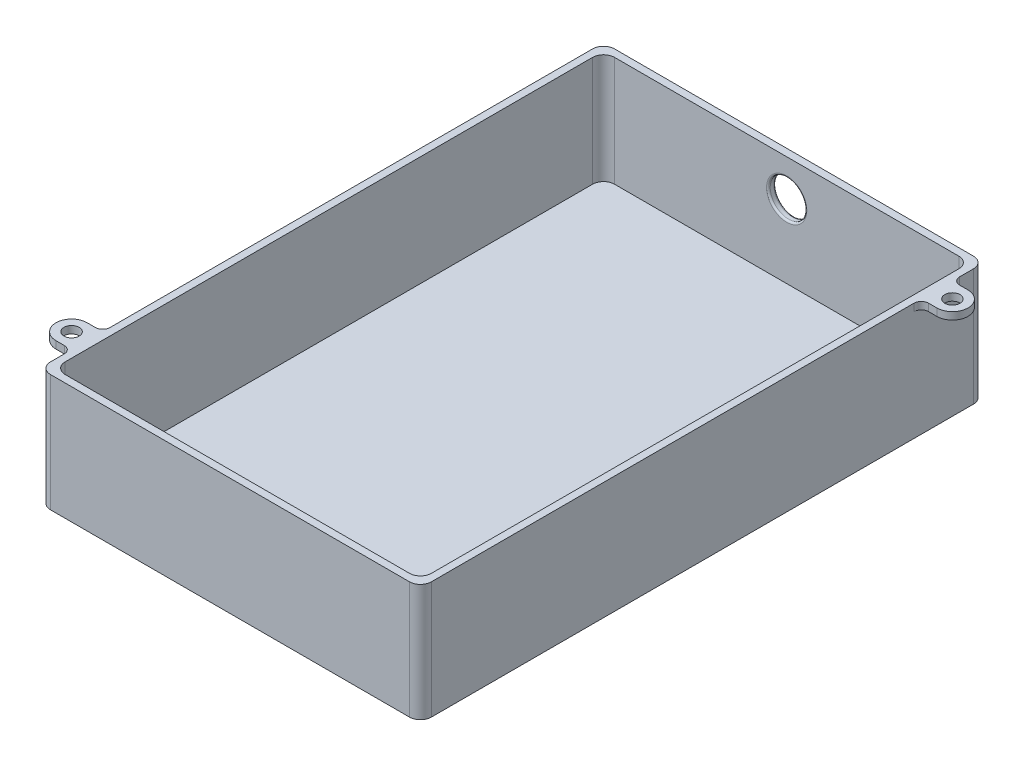
from build123d import *

# Parameters (mm, degrees)
SKETCH1_W           = 104
SKETCH1_H           = 154
SKETCH1_W_2         = 100
SKETCH1_H_2         = 150
BOSS_EXTRUDE1_DEPTH = 30
SKETCH1_2_W         = 104
SKETCH1_2_H         = 154
BOSS_EXTRUDE2_DEPTH = 2
FILLET1_R           = 3
SKETCH2_R           = 2.075
BOSS_EXTRUDE3_DEPTH = 2
SKETCH3_R           = 2.075
BOSS_EXTRUDE4_DEPTH = 2
SKETCH4_R           = 5
CUT_EXTRUDE1_DEPTH  = 10
FILLET2_R           = 0.5
FILLET3_R           = 2


with BuildPart() as part:
    # Sketch1 → Boss-Extrude1 (new body)
    with BuildSketch(Plane(origin=(0, 0, 0), x_dir=(1, 0, 0), z_dir=(0, 1, 0))):
        Rectangle(SKETCH1_W, SKETCH1_H)
        Rectangle(SKETCH1_W_2, SKETCH1_H_2, mode=Mode.SUBTRACT)
    extrude(amount=BOSS_EXTRUDE1_DEPTH)

    # Sketch1<2> → Boss-Extrude2 (add)
    with BuildSketch(Plane(origin=(0, 0, 0), x_dir=(1, 0, 0), z_dir=(0, 1, 0))):
        Rectangle(SKETCH1_2_W, SKETCH1_2_H)
    extrude(amount=-BOSS_EXTRUDE2_DEPTH)

    # Fillet1
    fillet1_edges = [part.edges().sort_by_distance(p)[0] for p in [
        (52, 14, -77),
        (52, 14, 77),
        (-52, 14, 77),
        (-52, 14, -77),
        (-50, 15, 75),
        (-50, 15, -75),
        (50, 15, -75),
        (50, 15, 75),
    ]]
    fillet(fillet1_edges, radius=FILLET1_R)

    # Sketch2 → Boss-Extrude3 (add)
    with BuildSketch(Plane(origin=(0, 30, 0), x_dir=(1, 0, 0), z_dir=(0, 1, 0))):
        with BuildLine():
            Line((56.25, 68.25), (52, 68.25))
            Line((52, 68.25), (52, 59.75))
            Line((52, 59.75), (56.25, 59.75))
            ThreePointArc((56.25, 59.75), (60.5, 64), (56.25, 68.25))
        make_face()
        with Locations((56.25, 64)):
            Circle(SKETCH2_R, mode=Mode.SUBTRACT)
    extrude(amount=-BOSS_EXTRUDE3_DEPTH)

    # Sketch3 → Boss-Extrude4 (add)
    with BuildSketch(Plane(origin=(0, 30, 0), x_dir=(1, 0, 0), z_dir=(0, 1, 0))):
        with BuildLine():
            Line((-52, -59.75), (-56.25, -59.75))
            ThreePointArc((-56.25, -59.75), (-60.5, -64), (-56.25, -68.25))
            Line((-56.25, -68.25), (-52, -68.25))
            Line((-52, -68.25), (-52, -59.75))
        make_face()
        with Locations((-56.25, -64)):
            Circle(SKETCH3_R, mode=Mode.SUBTRACT)
    extrude(amount=-BOSS_EXTRUDE4_DEPTH)

    # Sketch4 → Cut-Extrude1 (cut)
    with BuildSketch(Plane(origin=(0, 0, -77), x_dir=(-1, 0, 0), z_dir=(0, 0, -1))):
        with Locations((0, 20)):
            Circle(SKETCH4_R)
    extrude(amount=-CUT_EXTRUDE1_DEPTH, mode=Mode.SUBTRACT)

    # Fillet2
    fillet2_edges = [part.edges().sort_by_distance(p)[0] for p in [
        (5, 20, -75),
        (5, 20, -77),
    ]]
    fillet(fillet2_edges, radius=FILLET2_R)

    # Fillet3
    fillet3_edges = [part.edges().sort_by_distance(p)[0] for p in [
        (-52, 29, 68.25),
        (-52, 29, 59.75),
        (52, 29, -68.25),
        (52, 29, -59.75),
    ]]
    fillet(fillet3_edges, radius=FILLET3_R)


solid = part.part
